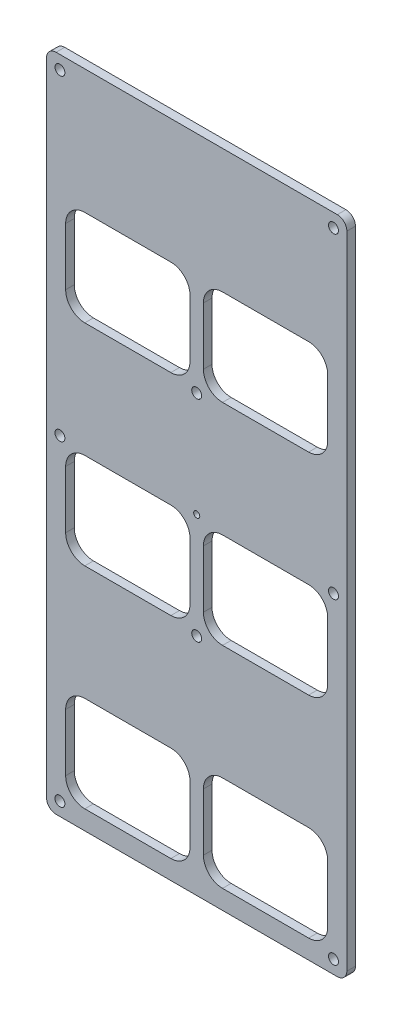
from build123d import *

# Parameters (mm, degrees)
SKETCH_1_W          = 157
SKETCH_1_H          = 345
EXTRUDE_1_DEPTH     = 4.5
CUT_EXTRUDE_1_DEPTH = 4.5
SKETCH_3_R          = 2.6
SKETCH_3_R_2        = 1.6
CUT_EXTRUDE_2_DEPTH = 4.5
FILLET_1_R          = 5


with BuildPart() as part:
    # 草图1 → 凸台-拉伸1 (new body)
    with BuildSketch(Plane.XY):
        with Locations((78.5, 172.5)):
            Rectangle(SKETCH_1_W, SKETCH_1_H)
    extrude(amount=EXTRUDE_1_DEPTH)

    # 草图2 → 切除-拉伸1 (cut)
    with BuildSketch(Plane.XY.offset(4.5)):
        with BuildLine():
            Line((20, 60), (65, 60))
            ThreePointArc((65, 60), (72.071067812, 57.071067812), (75, 50))
            Line((75, 50), (75, 20))
            ThreePointArc((75, 20), (72.071067812, 12.928932188), (65, 10))
            Line((65, 10), (20, 10))
            ThreePointArc((20, 10), (12.928932188, 12.928932188), (10, 20))
            Line((10, 20), (10, 50))
            ThreePointArc((10, 50), (12.928932188, 57.071067812), (20, 60))
        make_face()
        with BuildLine():
            Line((92, 60), (137, 60))
            ThreePointArc((137, 60), (144.071067812, 57.071067812), (147, 50))
            Line((147, 50), (147, 20))
            ThreePointArc((147, 20), (144.071067812, 12.928932188), (137, 10))
            Line((137, 10), (92, 10))
            ThreePointArc((92, 10), (84.928932188, 12.928932188), (82, 20))
            Line((82, 20), (82, 50))
            ThreePointArc((82, 50), (84.928932188, 57.071067812), (92, 60))
        make_face()
        with BuildLine():
            Line((92, 170), (137, 170))
            ThreePointArc((137, 170), (144.071067812, 167.071067812), (147, 160))
            Line((147, 160), (147, 130))
            ThreePointArc((147, 130), (144.071067812, 122.928932188), (137, 120))
            Line((137, 120), (92, 120))
            ThreePointArc((92, 120), (84.928932188, 122.928932188), (82, 130))
            Line((82, 130), (82, 160))
            ThreePointArc((82, 160), (84.928932188, 167.071067812), (92, 170))
        make_face()
        with BuildLine():
            Line((92, 280), (137, 280))
            ThreePointArc((137, 280), (144.071067812, 277.071067812), (147, 270))
            Line((147, 270), (147, 240))
            ThreePointArc((147, 240), (144.071067812, 232.928932188), (137, 230))
            Line((137, 230), (92, 230))
            ThreePointArc((92, 230), (84.928932188, 232.928932188), (82, 240))
            Line((82, 240), (82, 270))
            ThreePointArc((82, 270), (84.928932188, 277.071067812), (92, 280))
        make_face()
        with BuildLine():
            Line((20, 170), (65, 170))
            ThreePointArc((65, 170), (72.071067812, 167.071067812), (75, 160))
            Line((75, 160), (75, 130))
            ThreePointArc((75, 130), (72.071067812, 122.928932188), (65, 120))
            Line((65, 120), (20, 120))
            ThreePointArc((20, 120), (12.928932188, 122.928932188), (10, 130))
            Line((10, 130), (10, 160))
            ThreePointArc((10, 160), (12.928932188, 167.071067812), (20, 170))
        make_face()
        with BuildLine():
            Line((20, 280), (65, 280))
            ThreePointArc((65, 280), (72.071067812, 277.071067812), (75, 270))
            Line((75, 270), (75, 240))
            ThreePointArc((75, 240), (72.071067812, 232.928932188), (65, 230))
            Line((65, 230), (20, 230))
            ThreePointArc((20, 230), (12.928932188, 232.928932188), (10, 240))
            Line((10, 240), (10, 270))
            ThreePointArc((10, 270), (12.928932188, 277.071067812), (20, 280))
        make_face()
    extrude(amount=-CUT_EXTRUDE_1_DEPTH, mode=Mode.SUBTRACT)

    # 草图3 → 切除-拉伸2 (cut)
    with BuildSketch(Plane.XY.offset(4.5)):
        with Locations((7, 338)):
            Circle(SKETCH_3_R)
        with Locations((150, 338)):
            Circle(SKETCH_3_R)
        with Locations((150, 7)):
            Circle(SKETCH_3_R)
        with Locations((7, 7)):
            Circle(SKETCH_3_R)
        with Locations((150, 172.5)):
            Circle(SKETCH_3_R)
        with Locations((7, 172.5)):
            Circle(SKETCH_3_R)
        with Locations((78.5, 172.5)):
            Circle(SKETCH_3_R_2)
        with Locations((78.5, 227.5)):
            Circle(SKETCH_3_R)
        with Locations((78.5, 117.5)):
            Circle(SKETCH_3_R)
    extrude(amount=-CUT_EXTRUDE_2_DEPTH, mode=Mode.SUBTRACT)

    # 圆角1
    fillet_1_edges = [part.edges().sort_by_distance(p)[0] for p in [
        (0, 345, 2.25),
        (157, 345, 2.25),
        (157, 0, 2.25),
        (0, 0, 2.25),
    ]]
    fillet(fillet_1_edges, radius=FILLET_1_R)


solid = part.part
